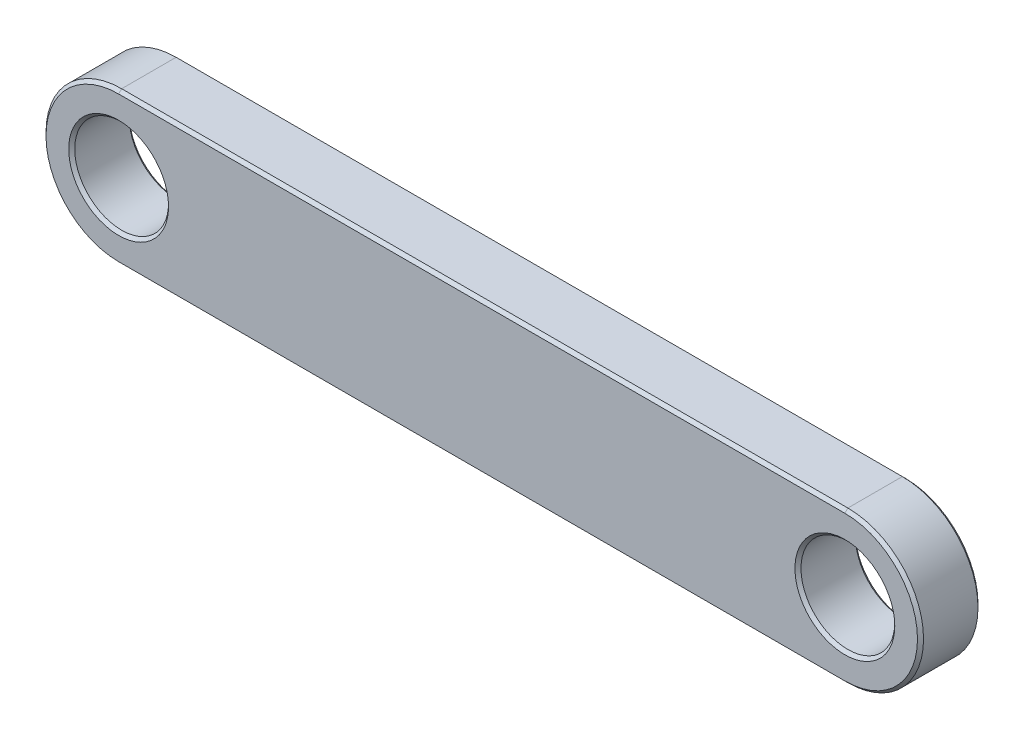
from build123d import *

# Parameters (mm, degrees)
SKETCH1_R           = 1.55
BOSS_EXTRUDE1_DEPTH = 2
CHAMFER1_SIZE       = 0.1


with BuildPart() as part:
    # Sketch1 → Boss-Extrude1 (new body)
    with BuildSketch(Plane.XY):
        with BuildLine():
            Line((-12, 2.5), (12, 2.5))
            ThreePointArc((12, 2.5), (14.5, 0), (12, -2.5))
            Line((12, -2.5), (-12, -2.5))
            ThreePointArc((-12, -2.5), (-14.5, 0), (-12, 2.5))
        make_face()
        with Locations((-12, 0)):
            Circle(SKETCH1_R, mode=Mode.SUBTRACT)
        with Locations((12, 0)):
            Circle(SKETCH1_R, mode=Mode.SUBTRACT)
    extrude(amount=BOSS_EXTRUDE1_DEPTH)

    # Chamfer1
    chamfer1_edges = [part.edges().sort_by_distance(p)[0] for p in [
        (-13.55, 0, 0),
        (-13.55, 0, 2),
        (14.5, 0, 2),
        (10.45, 0, 0),
        (10.45, 0, 2),
        (0, 2.5, 2),
        (-14.5, 0, 2),
        (0, 2.5, 0),
        (14.5, 0, 0),
        (0, -2.5, 0),
        (-14.5, 0, 0),
        (0, -2.5, 2),
    ]]
    chamfer(chamfer1_edges, length=CHAMFER1_SIZE)


solid = part.part
